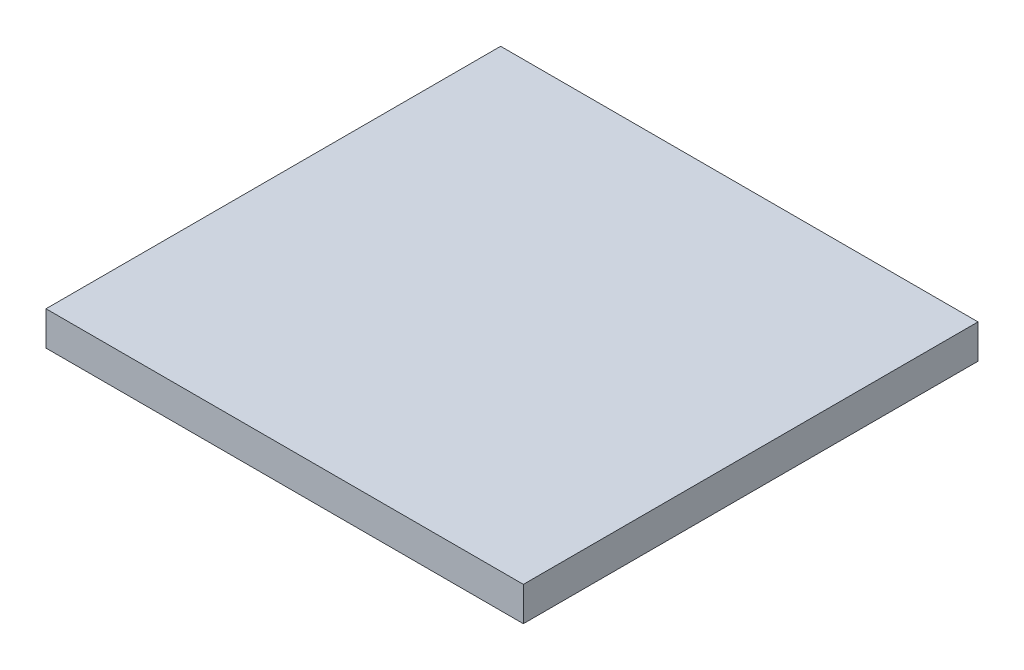
from build123d import *

# Parameters (mm, degrees)
SKETCH1_W           = 266.7
SKETCH1_H           = 254
BOSS_EXTRUDE1_DEPTH = 9.525


with BuildPart() as part:
    # Sketch1 → Boss-Extrude1 (new, symmetric)
    with BuildSketch(Plane(origin=(0, 0, 0), x_dir=(1, 0, 0), z_dir=(0, 1, 0))):
        Rectangle(SKETCH1_W, SKETCH1_H)
    extrude(amount=BOSS_EXTRUDE1_DEPTH, both=True)


solid = part.part
